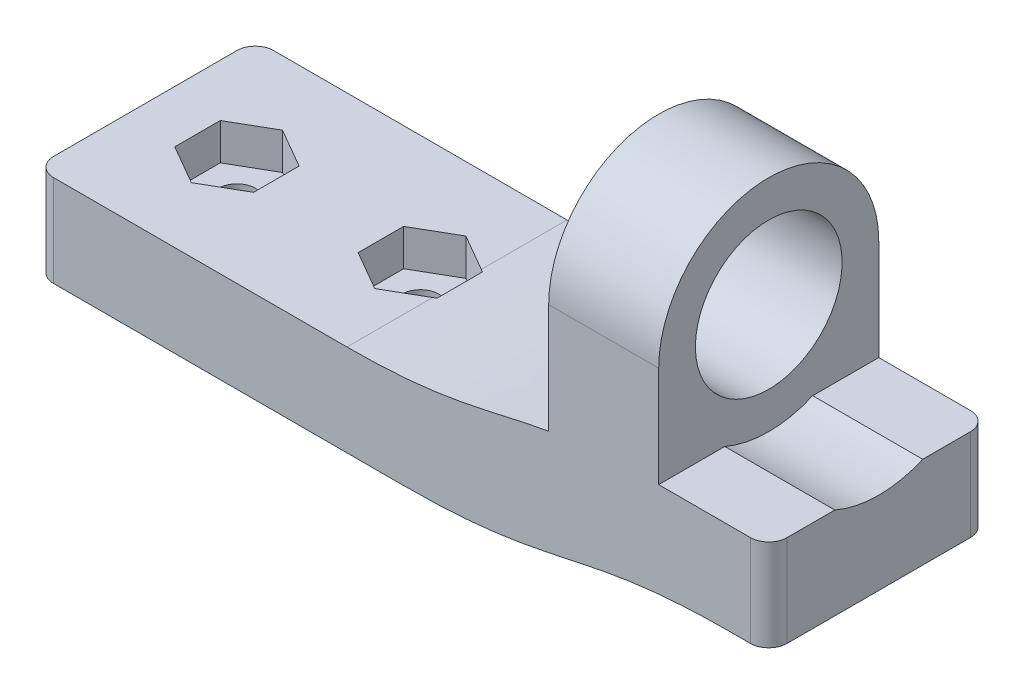
from build123d import *

# Parameters (mm, degrees)
BOSS_EXTRUDE1_DEPTH     = 12
SKETCH2_R               = 4
CUT_EXTRUDE1_DEPTH      = 46.675485921
SKETCH3_R               = 1
CUT_EXTRUDE2_DEPTH      = 46.67548588
FILLET2_R               = 1
SKETCH5_R               = 6
CUT_EXTRUDE3_DEPTH      = 10
CUT_EXTRUDE4_DEPTH      = 1
CUT_EXTRUDE4_DEPTH_BACK = 2


with BuildPart() as part:
    # Sketch1 → Boss-Extrude1 (new body)
    with BuildSketch(Plane.XY):
        with BuildLine():
            Line((0, 5), (0, 0))
            Line((0, 0), (20, 0))
            add(Edge.make_bspline(
                [(20, 0), (28.689683173, 0), (29.340198242, 2), (38, 2)],
                knots=[0, 0, 0, 0, 1, 1, 1, 1], degree=3))
            Line((38, 2), (40, 2))
            Line((40, 2), (40, 7))
            Line((40, 7), (34, 7))
            Line((34, 7), (34, 18.5))
            Line((34, 18.5), (28, 18.5))
            Line((28, 18.5), (28, 6.519175256))
            add(Edge.make_bspline(
                [(17, 5), (22.481298088, 5), (24.633063977, 5.927411475), (28, 6.519175256)],
                knots=[0, 0, 0, 0, 0.680959424, 0.680959424, 0.680959424, 0.680959424], degree=3))
            Line((17, 5), (0, 5))
        make_face()
    extrude(amount=BOSS_EXTRUDE1_DEPTH)

    # Sketch2 → Cut-Extrude1 (cut, through all)
    with BuildSketch(Plane(origin=(0, 0, 0), x_dir=(0, 0, -1), z_dir=(1, 0, 0))):
        with BuildLine():
            Line((0, 12.5), (0, 18.5))
            Line((0, 18.5), (-6, 18.5))
            ThreePointArc((-6, 18.5), (-1.757359313, 16.742640687), (0, 12.5))
        make_face()
        with BuildLine():
            ThreePointArc((-12, 12.5), (-10.242640687, 16.742640687), (-6, 18.5))
            Line((-6, 18.5), (-12, 18.5))
            Line((-12, 18.5), (-12, 12.5))
        make_face()
        with Locations(Location((-6, 12.5, 0), (0, 0, 180))):
            Circle(SKETCH2_R)
    extrude(amount=CUT_EXTRUDE1_DEPTH, mode=Mode.SUBTRACT)

    # Sketch3 → Cut-Extrude2 (cut, through all)
    with BuildSketch(Plane(origin=(0, 0, 0), x_dir=(1, 0, 0), z_dir=(0, 1, 0))):
        with Locations(Location((15, -6, 0), (0, 0, 270))):
            Circle(SKETCH3_R)
        with Locations(Location((5, -6, 0), (0, 0, 270))):
            Circle(SKETCH3_R)
    extrude(amount=CUT_EXTRUDE2_DEPTH, mode=Mode.SUBTRACT)

    # Fillet2
    fillet2_edges = [part.edges().sort_by_distance(p)[0] for p in [
        (0, 2.5, 12),
        (40, 4.5, 0),
        (0, 2.5, 0),
        (40, 4.5, 12),
    ]]
    fillet(fillet2_edges, radius=FILLET2_R)

    # Sketch5 → Cut-Extrude3 (cut)
    with BuildSketch(Plane(origin=(34, 0, 0), x_dir=(0, 0, -1), z_dir=(1, 0, 0))):
        with Locations((-6, 12.5)):
            Circle(SKETCH5_R)
    extrude(amount=CUT_EXTRUDE3_DEPTH, mode=Mode.SUBTRACT)

    # Sketch6 → Cut-Extrude4 (cut, two sides: drawn at the far end of the back side and taken through both)
    with BuildSketch(Plane(origin=(0, 5, 0), x_dir=(1, 0, 0), z_dir=(0, 1, 0)).offset(-CUT_EXTRUDE4_DEPTH_BACK)):
        Polygon((12.85, -4.758696921), (12.85, -7.241303079), (15, -8.482606158), (17.15, -7.241303079), (17.15, -4.758696921), (15, -3.517393842), align=None)
        Polygon((5, -3.517393842), (2.85, -4.758696921), (2.85, -7.241303079), (5, -8.482606158), (7.15, -7.241303079), (7.15, -4.758696921), align=None)
    extrude(amount=CUT_EXTRUDE4_DEPTH + CUT_EXTRUDE4_DEPTH_BACK, mode=Mode.SUBTRACT)


solid = part.part
